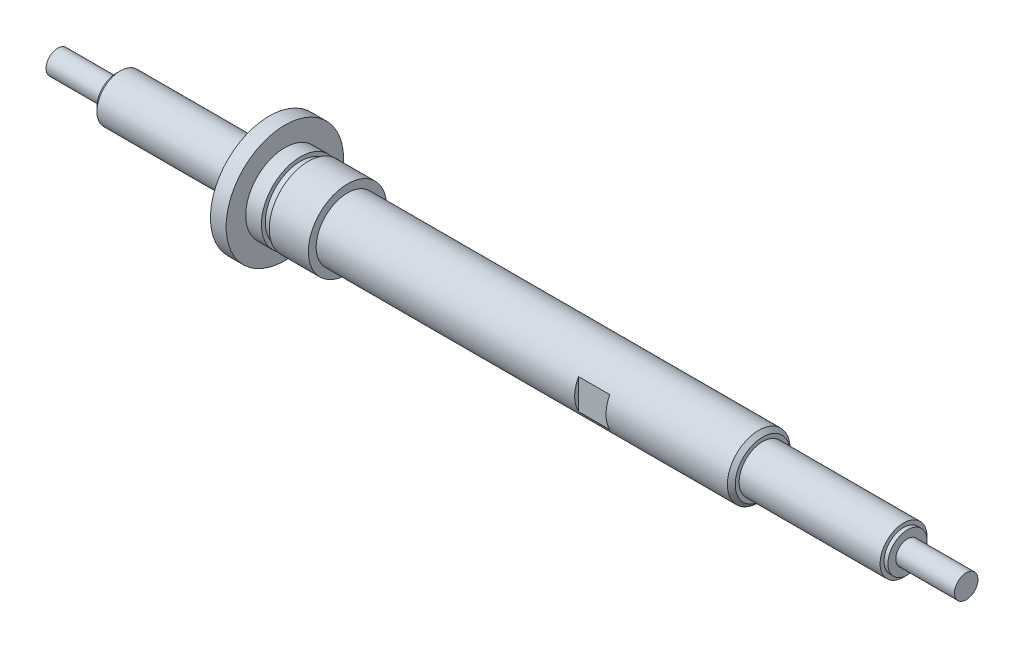
from build123d import *

# Parameters (mm, degrees)
SKETCH_1_R          = 4
EXTRUDE_1_DEPTH     = 1
SKETCH_2_R          = 3
EXTRUDE_2_DEPTH     = 9
SKETCH_3_R          = 3
EXTRUDE_3_DEPTH     = 17
SKETCH_4_R          = 7.5
EXTRUDE_4_DEPTH     = 2
SKETCH_5_R          = 5
EXTRUDE_5_DEPTH     = 8
SKETCH_6_R          = 4
EXTRUDE_6_DEPTH     = 53
EXTRUDE_START       = 9
SKETCH_7_R          = 3
EXTRUDE_7_DEPTH     = 9
EXTRUDE_START_2     = 17
SKETCH_8_R          = 3
EXTRUDE_8_DEPTH     = 17
CHAMFER_1_SIZE      = 0.5
CHAMFER_2_SIZE      = 0.5
CUT_EXTRUDE_START   = 2
SKETCH_11_R         = 5
SKETCH_11_R_2       = 4.5
CUT_EXTRUDE_2_DEPTH = 1
SKETCH_12_W         = 4
SKETCH_12_H         = 0.5
CUT_EXTRUDE_3_DEPTH = 5
SKETCH_14_R         = 3
SKETCH_14_R_2       = 1.5
CUT_EXTRUDE_5_DEPTH = 7.5
SKETCH_15_R         = 3
SKETCH_15_R_2       = 2.5
CUT_EXTRUDE_6_DEPTH = 0.5


with BuildPart() as part:
    # 草图1 → 凸台-拉伸1 (new body)
    with BuildSketch(Plane(origin=(0, 0, 0), x_dir=(0, 0, -1), z_dir=(1, 0, 0))):
        Circle(SKETCH_1_R)
    extrude(amount=EXTRUDE_1_DEPTH)

    # 草图2 → 凸台-拉伸2 (add)
    with BuildSketch(Plane.ZY):
        with Locations(Location((0, 0, 0), (0, 0, 180))):
            Circle(SKETCH_2_R)
    extrude(amount=EXTRUDE_2_DEPTH)

    # 草图3 → 凸台-拉伸3 (add)
    with BuildSketch(Plane.ZY.offset(9)):
        with Locations(Location((0, 0, 0), (0, 0, 180))):
            Circle(SKETCH_3_R)
    extrude(amount=EXTRUDE_3_DEPTH)

    # 草图4 → 凸台-拉伸4 (add)
    with BuildSketch(Plane(origin=(1, 0, 0), x_dir=(0, 0, -1), z_dir=(1, 0, 0))):
        Circle(SKETCH_4_R)
    extrude(amount=EXTRUDE_4_DEPTH)

    # 草图5 → 凸台-拉伸5 (add)
    with BuildSketch(Plane(origin=(3, 0, 0), x_dir=(0, 0, -1), z_dir=(1, 0, 0))):
        Circle(SKETCH_5_R)
    extrude(amount=EXTRUDE_5_DEPTH)

    # 草图6 → 凸台-拉伸6 (add)
    with BuildSketch(Plane(origin=(11, 0, 0), x_dir=(0, 0, -1), z_dir=(1, 0, 0))):
        Circle(SKETCH_6_R)
    extrude(amount=EXTRUDE_6_DEPTH)

    # 草图7 → 凸台-拉伸7 (add)
    with BuildSketch(Plane(origin=(64, 0, 0), x_dir=(0, 0, -1), z_dir=(1, 0, 0)).offset(EXTRUDE_START)):
        Circle(SKETCH_7_R)
    extrude(amount=-EXTRUDE_7_DEPTH)

    # 草图8 → 凸台-拉伸8 (add)
    with BuildSketch(Plane(origin=(73, 0, 0), x_dir=(0, 0, -1), z_dir=(1, 0, 0)).offset(EXTRUDE_START_2)):
        Circle(SKETCH_8_R)
    extrude(amount=-EXTRUDE_8_DEPTH)

    # 倒角1
    chamfer_1_edges = [part.edges().sort_by_distance(p)[0] for p in [
        (64, 0, 4),
    ]]
    chamfer(chamfer_1_edges, length=CHAMFER_1_SIZE)

    # 倒角2
    chamfer_2_edges = [part.edges().sort_by_distance(p)[0] for p in [
        (0, 0, 4),
    ]]
    chamfer(chamfer_2_edges, length=CHAMFER_2_SIZE)

    # 草图11 → 切除-拉伸2 (cut)
    with BuildSketch(Plane(origin=(3, 0, 0), x_dir=(0, 0, -1), z_dir=(1, 0, 0)).offset(CUT_EXTRUDE_START)):
        Circle(SKETCH_11_R)
        Circle(SKETCH_11_R_2, mode=Mode.SUBTRACT)
    extrude(amount=CUT_EXTRUDE_2_DEPTH, mode=Mode.SUBTRACT)

    # 草图12 → 切除-拉伸3 (cut, symmetric)
    with BuildSketch(Plane(origin=(0, 0, 0), x_dir=(1, 0, 0), z_dir=(0, 1, 0))):
        with Locations((46, 3.75)):
            Rectangle(SKETCH_12_W, SKETCH_12_H)
        with Locations((46, -3.75)):
            Rectangle(SKETCH_12_W, SKETCH_12_H)
    extrude(amount=CUT_EXTRUDE_3_DEPTH, both=True, mode=Mode.SUBTRACT)

    # 草图14 → 切除-拉伸5 (cut)
    with BuildSketch(Plane(origin=(90, 0, 0), x_dir=(0, 0, -1), z_dir=(1, 0, 0))):
        Circle(SKETCH_14_R)
        Circle(SKETCH_14_R_2, mode=Mode.SUBTRACT)
    cut_extrude_5 = extrude(amount=-CUT_EXTRUDE_5_DEPTH, mode=Mode.SUBTRACT)

    # 草图15 → 切除-拉伸6 (cut)
    with BuildSketch(Plane(origin=(82.5, 0, 0), x_dir=(0, 0, -1), z_dir=(1, 0, 0))):
        Circle(SKETCH_15_R)
        Circle(SKETCH_15_R_2, mode=Mode.SUBTRACT)
    cut_extrude_6 = extrude(amount=-CUT_EXTRUDE_6_DEPTH, mode=Mode.SUBTRACT)

    # 镜向2: 切除-拉伸5, 切除-拉伸6 across plane
    add(cut_extrude_5.mirror(Plane(origin=(32, 0, 0), x_dir=(0, 0, 1), z_dir=(1, 0, 0))), mode=Mode.SUBTRACT)
    add(cut_extrude_6.mirror(Plane(origin=(32, 0, 0), x_dir=(0, 0, 1), z_dir=(1, 0, 0))), mode=Mode.SUBTRACT)


solid = part.part
